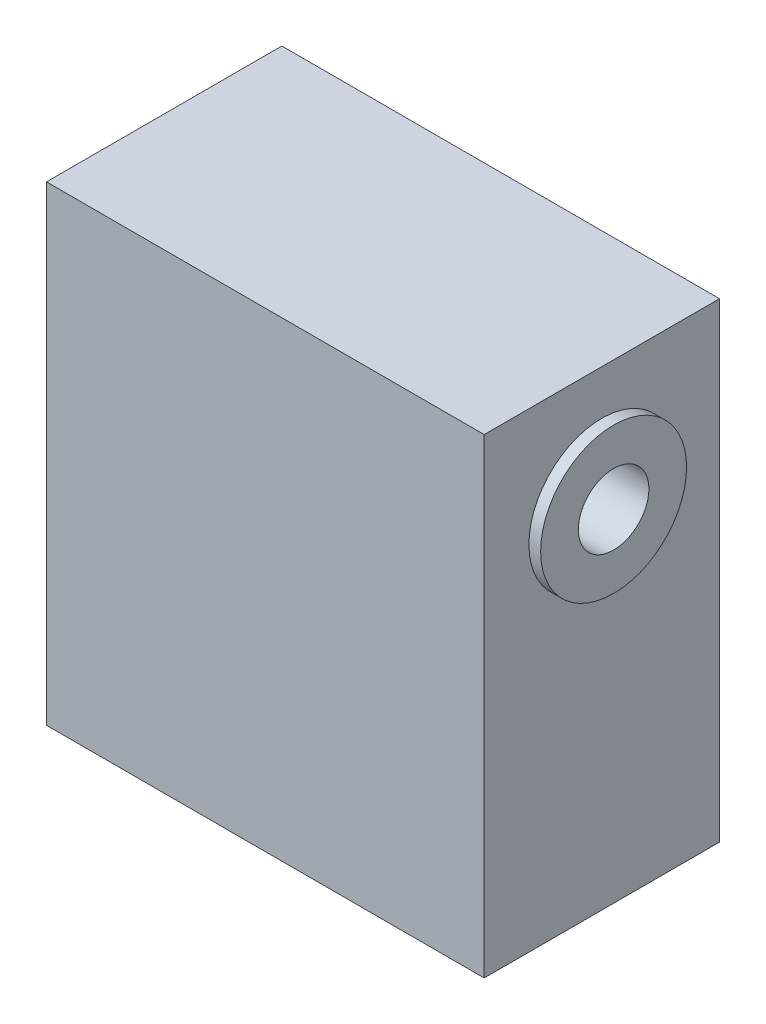
from build123d import *

# Parameters (mm, degrees)
SKETCH1_W           = 37.2
SKETCH1_H           = 20
BOSS_EXTRUDE1_DEPTH = 40
SKETCH2_R           = 6.2
BOSS_EXTRUDE2_DEPTH = 1
SKETCH3_R           = 3
CUT_EXTRUDE1_DEPTH  = 10


with BuildPart() as part:
    # Sketch1 → Boss-Extrude1 (new body)
    with BuildSketch(Plane(origin=(0, 0, 0), x_dir=(1, 0, 0), z_dir=(0, 1, 0))):
        with Locations((-18.6, 10)):
            Rectangle(SKETCH1_W, SKETCH1_H)
    extrude(amount=BOSS_EXTRUDE1_DEPTH)

    # Sketch2 → Boss-Extrude2 (add)
    with BuildSketch(Plane(origin=(0, 0, 0), x_dir=(0, 0, -1), z_dir=(1, 0, 0))):
        with Locations(Location((10, 30, 0), (0, 0, 180))):
            Circle(SKETCH2_R)
    extrude(amount=BOSS_EXTRUDE2_DEPTH)

    # Sketch3 → Cut-Extrude1 (cut)
    with BuildSketch(Plane(origin=(1, 0, 0), x_dir=(0, 0, -1), z_dir=(1, 0, 0))):
        with Locations((10, 30)):
            Circle(SKETCH3_R)
    extrude(amount=-CUT_EXTRUDE1_DEPTH, mode=Mode.SUBTRACT)


solid = part.part
